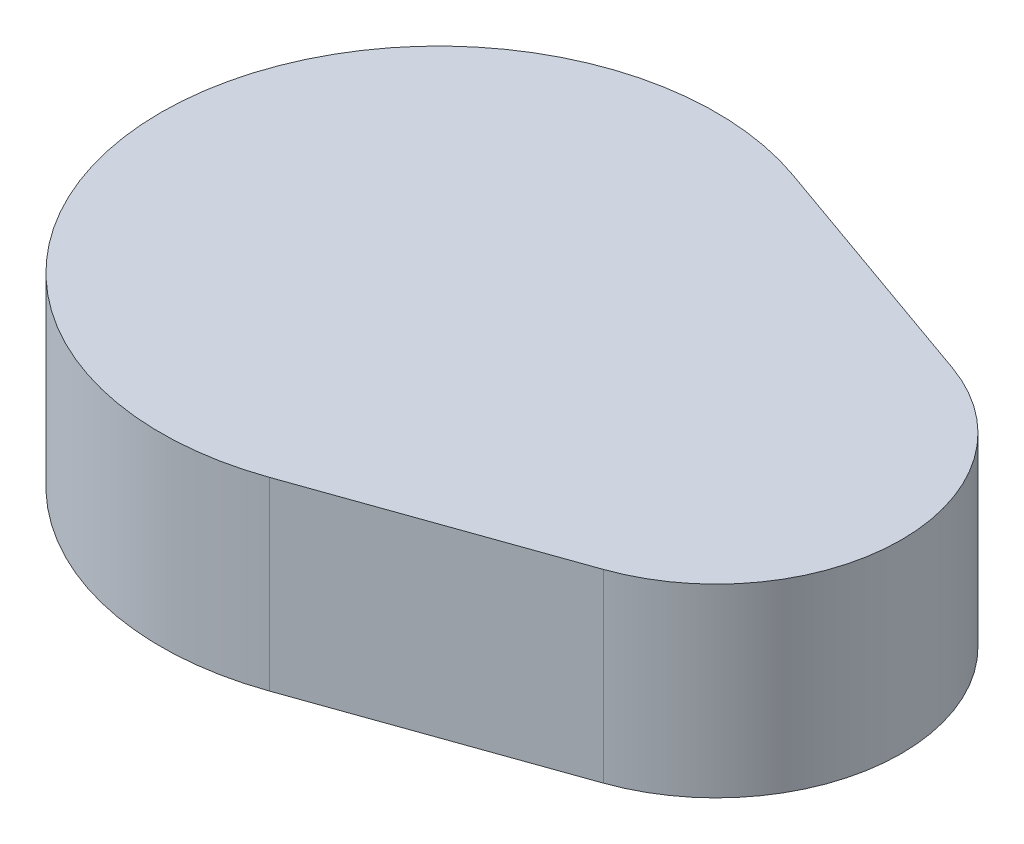
from build123d import *

# Parameters (mm, degrees)
EXTRUDE_1_DEPTH = 10


with BuildPart() as part:
    # 草图1 → 凸台-拉伸1 (new body)
    with BuildSketch(Plane(origin=(0, 0, 0), x_dir=(1, 0, 0), z_dir=(0, 1, 0))):
        with BuildLine():
            Line((5, 14.142135624), (18.333333333, 9.428090416))
            ThreePointArc((18.333333333, 9.428090416), (25, 0), (18.333333333, -9.428090416))
            Line((18.333333333, -9.428090416), (5, -14.142135624))
            ThreePointArc((5, -14.142135624), (-15, 0), (5, 14.142135624))
        make_face()
    extrude(amount=EXTRUDE_1_DEPTH)


solid = part.part
